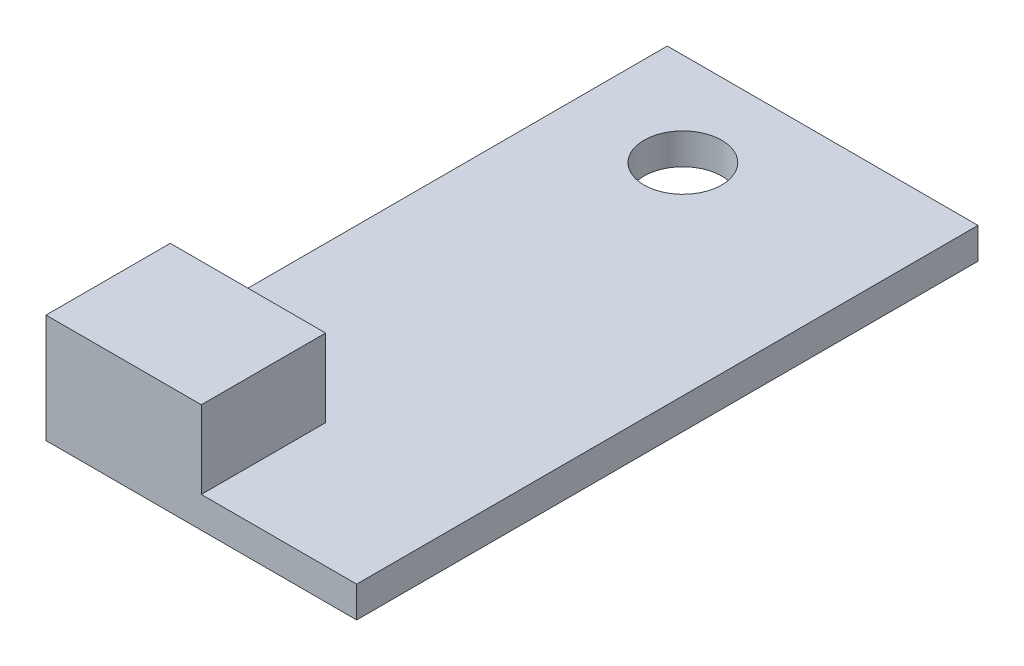
from build123d import *

# Parameters (mm, degrees)
CROQUIS1_W                      = 100
CROQUIS1_H                      = 200
SALIENTE_EXTRUIR1_DEPTH         = 10
CROQUIS2_W                      = 50
CROQUIS2_H                      = 40
SALIENTE_EXTRUIR2_DEPTH         = 25
DI_METRO_DE_TALADRO_25_0_25_2_D = 25


with BuildPart() as part:
    # Croquis1 → Saliente-Extruir1 (new body)
    with BuildSketch(Plane(origin=(0, 0, 0), x_dir=(1, 0, 0), z_dir=(0, 1, 0))):
        Rectangle(CROQUIS1_W, CROQUIS1_H)
    extrude(amount=SALIENTE_EXTRUIR1_DEPTH)

    # Croquis2 → Saliente-Extruir2 (add)
    with BuildSketch(Plane(origin=(0, 10, 0), x_dir=(1, 0, 0), z_dir=(0, 1, 0))):
        with Locations((-25, -80)):
            Rectangle(CROQUIS2_W, CROQUIS2_H)
    extrude(amount=SALIENTE_EXTRUIR2_DEPTH)

    # Diámetro de taladro Ø25.0 (25)2 (through all)
    with Locations(Plane(origin=(0, 10, 0), x_dir=(1, 0, 0), z_dir=(0, 1, 0))):
        with Locations((-15, 70)):
            Hole(DI_METRO_DE_TALADRO_25_0_25_2_D / 2)


solid = part.part
